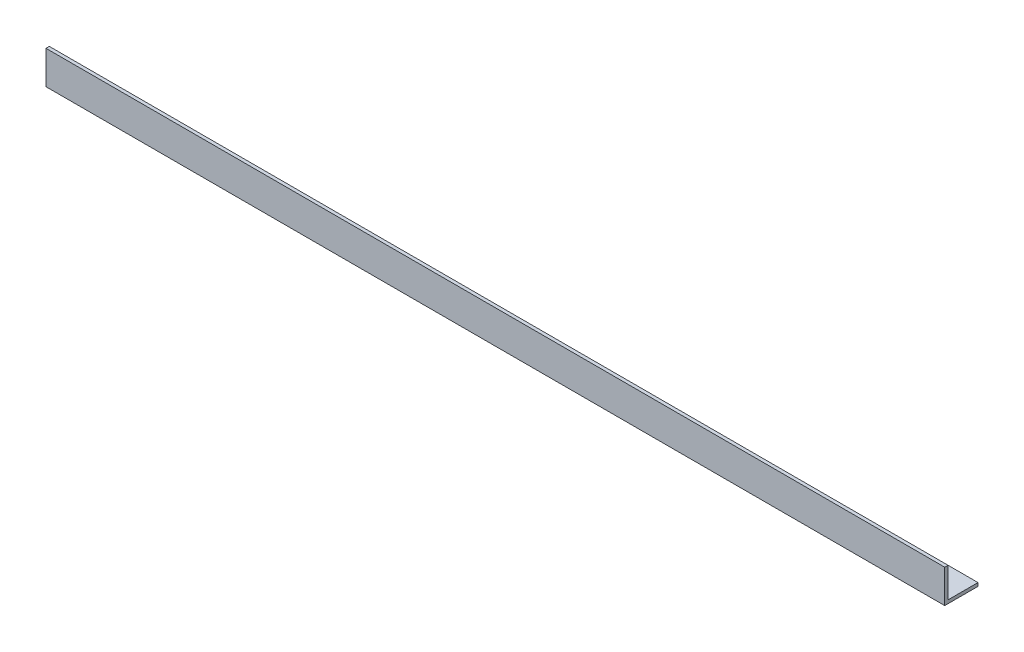
from build123d import *

# Parameters (mm, degrees)
EXTRUDE_1_DEPTH     = 270
SKETCH_2_R          = 1.5
CUT_EXTRUDE_1_DEPTH = 1


with BuildPart() as part:
    # Эскиз1 → Бобышка-Вытянуть1 (new body)
    with BuildSketch(Plane(origin=(0, 0, 0), x_dir=(0, 0, -1), z_dir=(1, 0, 0))):
        Polygon((-5, 5), (-4, 5), (-4, -4), (5, -4), (5, -5), (-5, -5), align=None)
    extrude(amount=EXTRUDE_1_DEPTH)

    # Эскиз2 → Вырез-Вытянуть1 (cut)
    with BuildSketch(Plane(origin=(0, -4, 0), x_dir=(1, 0, 0), z_dir=(0, 1, 0))):
        with Locations(Location((135, 0.5, 0), (0, 0, 270))):
            Circle(SKETCH_2_R)
        with Locations(Location((72.5, 0.5, 0), (0, 0, 270))):
            Circle(SKETCH_2_R)
        with Locations(Location((10, 0.5, 0), (0, 0, 270))):
            Circle(SKETCH_2_R)
        with Locations(Location((260, 0.5, 0), (0, 0, 270))):
            Circle(SKETCH_2_R)
        with Locations(Location((197.5, 0.5, 0), (0, 0, 270))):
            Circle(SKETCH_2_R)
    extrude(amount=-CUT_EXTRUDE_1_DEPTH, mode=Mode.SUBTRACT)


solid = part.part
